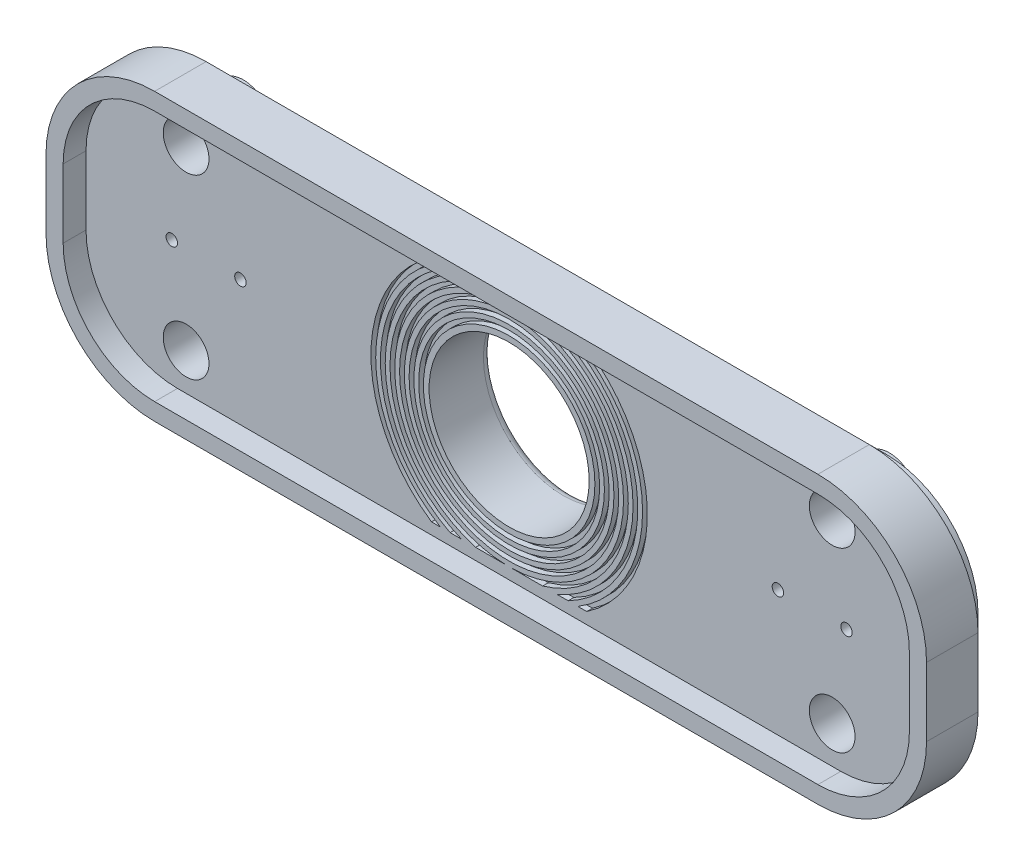
from build123d import *

# Parameters (mm, degrees)
BOSS_EXTRUDE1_DEPTH      = 1
BOSS_EXTRUDE2_DEPTH      = 3
BOSS_EXTRUDE2_DEPTH_BACK = 1.5
BOSS_EXTRUDE3_START      = 2
BOSS_EXTRUDE3_DEPTH      = 2
SKETCH3_R                = 7
SKETCH3_R_2              = 2
SKETCH3_R_3              = 0.5
CUT_EXTRUDE1_DEPTH       = 41.675545479
SKETCH4_R                = 8.5
SKETCH4_R_2              = 7
BOSS_EXTRUDE4_DEPTH      = 3.5
SKETCH5_R                = 4.25
SKETCH5_R_2              = 3.1
BOSS_EXTRUDE5_DEPTH      = 3.9
SKETCH6_R                = 2.5
SKETCH6_R_2              = 1.6
BOSS_EXTRUDE6_DEPTH      = 4.5
SKETCH7_R                = 2.5
SKETCH7_R_2              = 2
BOSS_EXTRUDE7_DEPTH      = 3
FILLET1_R                = 0.75
CHAMFER1_SIZE            = 0.75
CHAMFER2_SIZE            = 0.6
SKETCH8_R                = 9.583333337
SKETCH8_R_2              = 9.16666667
SKETCH8_R_3              = 8.750000003
SKETCH8_R_4              = 8.333333337
SKETCH8_R_5              = 7.91666667
SKETCH8_R_6              = 7.5
CUT_EXTRUDE6_DEPTH       = 0.5


with BuildPart() as part:
    # Sketch1 → Boss-Extrude1 (new, symmetric)
    with BuildSketch(Plane.XY):
        with BuildLine():
            Line((-29, 11), (29, 11))
            ThreePointArc((29, 11), (34.656854249, 8.656854249), (37, 3))
            Line((37, 3), (37, -3))
            ThreePointArc((37, -3), (34.656854249, -8.656854249), (29, -11))
            Line((29, -11), (-29, -11))
            ThreePointArc((-29, -11), (-34.656854249, -8.656854249), (-37, -3))
            Line((-37, -3), (-37, 3))
            ThreePointArc((-37, 3), (-34.656854249, 8.656854249), (-29, 11))
        make_face()
    extrude(amount=BOSS_EXTRUDE1_DEPTH, both=True)

    # Sketch1<4> → Boss-Extrude2 (add, two sides: drawn at the far end of the back side and taken through both)
    with BuildSketch(Plane.XY.offset(-BOSS_EXTRUDE2_DEPTH_BACK)):
        with BuildLine():
            Line((-29, 12.5), (29, 12.5))
            ThreePointArc((29, 12.5), (35.717514421, 9.717514421), (38.5, 3))
            Line((38.5, 3), (38.5, -3))
            ThreePointArc((38.5, -3), (35.717514421, -9.717514421), (29, -12.5))
            Line((29, -12.5), (-29, -12.5))
            ThreePointArc((-29, -12.5), (-35.717514421, -9.717514421), (-38.5, -3))
            Line((-38.5, -3), (-38.5, 3))
            ThreePointArc((-38.5, 3), (-35.717514421, 9.717514421), (-29, 12.5))
        make_face()
        with BuildLine():
            Line((-29, 11), (29, 11))
            ThreePointArc((29, 11), (34.656854249, 8.656854249), (37, 3))
            Line((37, 3), (37, -3))
            ThreePointArc((37, -3), (34.656854249, -8.656854249), (29, -11))
            Line((29, -11), (-29, -11))
            ThreePointArc((-29, -11), (-34.656854249, -8.656854249), (-37, -3))
            Line((-37, -3), (-37, 3))
            ThreePointArc((-37, 3), (-34.656854249, 8.656854249), (-29, 11))
        make_face(mode=Mode.SUBTRACT)
    extrude(amount=BOSS_EXTRUDE2_DEPTH + BOSS_EXTRUDE2_DEPTH_BACK)

    # Sketch2 → Boss-Extrude3 (add)
    with BuildSketch(Plane(origin=(0, 0, -1), x_dir=(-1, 0, 0), z_dir=(0, 0, -1)).offset(BOSS_EXTRUDE3_START)):
        with BuildLine():
            Line((29, 11), (-29, 11))
            ThreePointArc((-29, 11), (-34.656854249, 8.656854249), (-37, 3))
            Line((-37, 3), (-37, -3))
            ThreePointArc((-37, -3), (-34.656854249, -8.656854249), (-29, -11))
            Line((-29, -11), (29, -11))
            ThreePointArc((29, -11), (34.656854249, -8.656854249), (37, -3))
            Line((37, -3), (37, 3))
            ThreePointArc((37, 3), (34.656854249, 8.656854249), (29, 11))
        make_face()
        with BuildLine():
            Line((29, 10), (-29, 10))
            ThreePointArc((-29, 10), (-33.949747468, 7.949747468), (-36, 3))
            Line((-36, 3), (-36, -3))
            ThreePointArc((-36, -3), (-33.949747468, -7.949747468), (-29, -10))
            Line((-29, -10), (29, -10))
            ThreePointArc((29, -10), (33.949747468, -7.949747468), (36, -3))
            Line((36, -3), (36, 3))
            ThreePointArc((36, 3), (33.949747468, 7.949747468), (29, 10))
        make_face(mode=Mode.SUBTRACT)
    extrude(amount=-BOSS_EXTRUDE3_DEPTH)

    # Sketch3 → Cut-Extrude1 (cut, through all)
    with BuildSketch(Plane.XY.offset(1)):
        Circle(SKETCH3_R)
        with Locations((-28.25, 7.75)):
            Circle(SKETCH3_R_2)
        with Locations((28.25, 7.75)):
            Circle(SKETCH3_R_2)
        with Locations((28.25, -7.75)):
            Circle(SKETCH3_R_2)
        with Locations((-28.25, -7.75)):
            Circle(SKETCH3_R_2)
        with Locations((-29.5, 0)):
            Circle(SKETCH3_R_3)
        with Locations((29.5, 0)):
            Circle(SKETCH3_R_3)
        with Locations((23.5, 0)):
            Circle(SKETCH3_R_3)
        with Locations((-23.5, 0)):
            Circle(SKETCH3_R_3)
    extrude(amount=-CUT_EXTRUDE1_DEPTH, mode=Mode.SUBTRACT)

    # Sketch4 → Boss-Extrude4 (add)
    with BuildSketch(Plane(origin=(0, 0, -1), x_dir=(-1, 0, 0), z_dir=(0, 0, -1))):
        with Locations(Location((0, 0, 0), (0, 0, 180))):
            Circle(SKETCH4_R)
        with Locations(Location((0, 0, 0), (0, 0, 180))):
            Circle(SKETCH4_R_2, mode=Mode.SUBTRACT)
    extrude(amount=BOSS_EXTRUDE4_DEPTH)

    # Sketch5 → Boss-Extrude5 (add)
    # profile 1 of 2: a face of its own
    with BuildSketch(Plane(origin=(0, 0, -1), x_dir=(-1, 0, 0), z_dir=(0, 0, -1))):
        with Locations(Location((29.5, 0, 0), (0, 0, 180))):
            Circle(SKETCH5_R)
        with Locations((29.5, 0)):
            Circle(SKETCH5_R_2, mode=Mode.SUBTRACT)
    # profile 2 of 2: a face of its own
    with BuildSketch(Plane(origin=(0, 0, -1), x_dir=(-1, 0, 0), z_dir=(0, 0, -1))):
        with Locations(Location((-29.5, 0, 0), (0, 0, 180))):
            Circle(SKETCH5_R)
        with Locations((-29.5, 0)):
            Circle(SKETCH5_R_2, mode=Mode.SUBTRACT)
    extrude(amount=BOSS_EXTRUDE5_DEPTH)

    # Sketch6 → Boss-Extrude6 (add)
    # profile 1 of 2: a face of its own
    with BuildSketch(Plane(origin=(0, 0, -1), x_dir=(-1, 0, 0), z_dir=(0, 0, -1))):
        with Locations(Location((23.5, 0, 0), (0, 0, 323.731147776))):
            Circle(SKETCH6_R)
        with Locations((23.5, 0)):
            Circle(SKETCH6_R_2, mode=Mode.SUBTRACT)
    # profile 2 of 2: a face of its own
    with BuildSketch(Plane(origin=(0, 0, -1), x_dir=(-1, 0, 0), z_dir=(0, 0, -1))):
        with Locations(Location((-23.5, 0, 0), (0, 0, 216.268852224))):
            Circle(SKETCH6_R)
        with Locations((-23.5, 0)):
            Circle(SKETCH6_R_2, mode=Mode.SUBTRACT)
    extrude(amount=BOSS_EXTRUDE6_DEPTH)

    # Sketch7 → Boss-Extrude7 (add)
    # profile 1 of 4: a face of its own
    with BuildSketch(Plane(origin=(0, 0, -1), x_dir=(-1, 0, 0), z_dir=(0, 0, -1))):
        with Locations(Location((-28.25, 7.75, 0), (0, 0, 116.320774831))):
            Circle(SKETCH7_R)
        with Locations(Location((-28.25, 7.75, 0), (0, 0, 180))):
            Circle(SKETCH7_R_2, mode=Mode.SUBTRACT)
    # profile 2 of 4: a face of its own
    with BuildSketch(Plane(origin=(0, 0, -1), x_dir=(-1, 0, 0), z_dir=(0, 0, -1))):
        with Locations(Location((-28.25, -7.75, 0), (0, 0, 243.679225169))):
            Circle(SKETCH7_R)
        with Locations(Location((-28.25, -7.75, 0), (0, 0, 180))):
            Circle(SKETCH7_R_2, mode=Mode.SUBTRACT)
    # profile 3 of 4: a face of its own
    with BuildSketch(Plane(origin=(0, 0, -1), x_dir=(-1, 0, 0), z_dir=(0, 0, -1))):
        with Locations(Location((28.25, 7.75, 0), (0, 0, 115.841932763))):
            Circle(SKETCH7_R)
        with Locations(Location((28.25, 7.75, 0), (0, 0, 180))):
            Circle(SKETCH7_R_2, mode=Mode.SUBTRACT)
    # profile 4 of 4: a face of its own
    with BuildSketch(Plane(origin=(0, 0, -1), x_dir=(-1, 0, 0), z_dir=(0, 0, -1))):
        with Locations(Location((28.25, -7.75, 0), (0, 0, 244.158067237))):
            Circle(SKETCH7_R)
        with Locations(Location((28.25, -7.75, 0), (0, 0, 180))):
            Circle(SKETCH7_R_2, mode=Mode.SUBTRACT)
    extrude(amount=BOSS_EXTRUDE7_DEPTH)

    # Fillet1
    fillet1_edges = [part.edges().sort_by_distance(p)[0] for p in [
        (-7, 0, -4.5),
    ]]
    fillet(fillet1_edges, radius=FILLET1_R)

    # Chamfer1
    chamfer1_edges = [part.edges().sort_by_distance(p)[0] for p in [
        (-24, 0, -1),
        (23, 0, -1),
        (29, 0, -1),
        (-30, 0, -1),
    ]]
    chamfer(chamfer1_edges, length=CHAMFER1_SIZE)

    # Chamfer2
    chamfer2_edges = [part.edges().sort_by_distance(p)[0] for p in [
        (-21.9, 0, -5.5),
        (25.1, 0, -5.5),
    ]]
    chamfer(chamfer2_edges, length=CHAMFER2_SIZE)

    # Sketch8 → Cut-Extrude6 (cut)
    # profile 1 of 9: a face of its own
    with BuildSketch(Plane.XY.offset(1)):
        Circle(SKETCH8_R)
        Circle(SKETCH8_R_2, mode=Mode.SUBTRACT)
    # profile 2 of 9: a face of its own
    with BuildSketch(Plane.XY.offset(1)):
        Circle(SKETCH8_R_3)
        Circle(SKETCH8_R_4, mode=Mode.SUBTRACT)
    # profile 3 of 9: a face of its own
    with BuildSketch(Plane.XY.offset(1)):
        Circle(SKETCH8_R_5)
        Circle(SKETCH8_R_6, mode=Mode.SUBTRACT)
    # profile 4 of 9: a face of its own
    with BuildSketch(Plane.XY.offset(1)):
        with BuildLine():
            Line((-0.258220535, 10), (-2.928549141, 10))
            ThreePointArc((-2.928549141, 10), (-10.420000003, 0), (-2.928549141, -10))
            Line((-2.928549141, -10), (-0.258220535, -10))
            ThreePointArc((-0.258220535, -10), (-10.003333337, 0), (-0.258220535, 10))
        make_face()
    # profile 5 of 9: a face of its own
    with BuildSketch(Plane.XY.offset(1)):
        with BuildLine():
            Line((-4.175325678, 10), (-5.161154056, 10))
            ThreePointArc((-5.161154056, 10), (-11.253333337, 0), (-5.161154056, -10))
            Line((-5.161154056, -10), (-4.175325678, -10))
            ThreePointArc((-4.175325678, -10), (-10.83666667, 0), (-4.175325678, 10))
        make_face()
    # profile 6 of 9: a face of its own
    with BuildSketch(Plane.XY.offset(1)):
        with BuildLine():
            Line((-6.015721077, 10), (-6.788778328, 10))
            ThreePointArc((-6.788778328, 10), (-12.08666667, 0), (-6.788778328, -10))
            Line((-6.788778328, -10), (-6.015721077, -10))
            ThreePointArc((-6.015721077, -10), (-11.670000003, 0), (-6.015721077, 10))
        make_face()
    # profile 7 of 9: a face of its own
    with BuildSketch(Plane.XY.offset(1)):
        with BuildLine():
            Line((2.928549141, 10), (0.258220535, 10))
            ThreePointArc((0.258220535, 10), (7.164137908, 6.981533204), (10.003333337, 0))
            ThreePointArc((10.003333337, 0), (7.164137908, -6.981533204), (0.258220535, -10))
            Line((0.258220535, -10), (2.928549141, -10))
            ThreePointArc((2.928549141, -10), (10.420000003, 0), (2.928549141, 10))
        make_face()
    # profile 8 of 9: a face of its own
    with BuildSketch(Plane.XY.offset(1)):
        with BuildLine():
            Line((5.161154056, 10), (4.175325678, 10))
            ThreePointArc((4.175325678, 10), (10.83666667, 0), (4.175325678, -10))
            Line((4.175325678, -10), (5.161154056, -10))
            ThreePointArc((5.161154056, -10), (11.253333337, 0), (5.161154056, 10))
        make_face()
    # profile 9 of 9: a face of its own
    with BuildSketch(Plane.XY.offset(1)):
        with BuildLine():
            Line((6.788778328, 10), (6.015721077, 10))
            ThreePointArc((6.015721077, 10), (11.670000003, 0), (6.015721077, -10))
            Line((6.015721077, -10), (6.788778328, -10))
            ThreePointArc((6.788778328, -10), (12.08666667, 0), (6.788778328, 10))
        make_face()
    extrude(amount=-CUT_EXTRUDE6_DEPTH, mode=Mode.SUBTRACT)


solid = part.part
